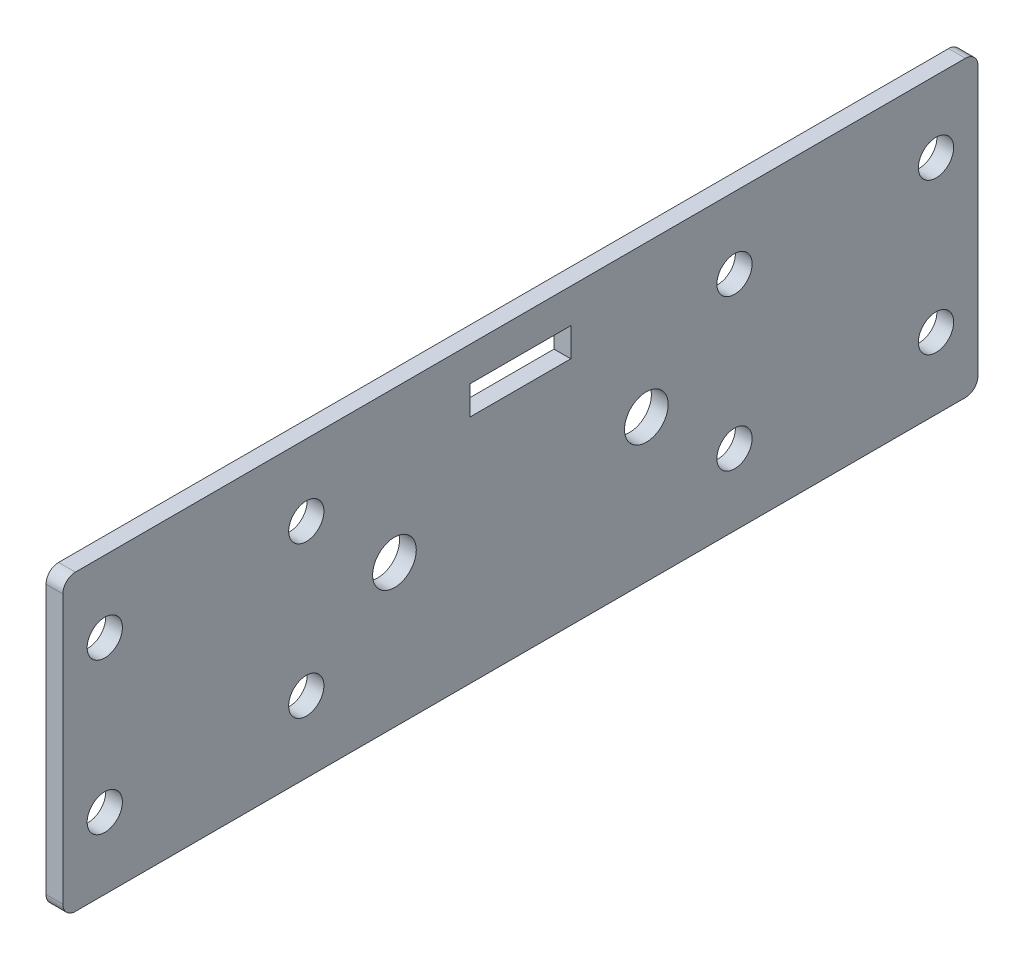
from build123d import *

# Parameters (mm, degrees)
SKETCH1_W           = 109
SKETCH1_H           = 35
SKETCH1_R           = 2.1
SKETCH1_R_2         = 2.6
SKETCH1_W_2         = 12
SKETCH1_H_2         = 3.42
BOSS_EXTRUDE1_DEPTH = 2
FILLET1_R           = 1.5


with BuildPart() as part:
    # Sketch1 → Boss-Extrude1 (new body)
    with BuildSketch(Plane(origin=(0, 0, 0), x_dir=(0, 0, -1), z_dir=(1, 0, 0))):
        with Locations((54.5, -17.5)):
            Rectangle(SKETCH1_W, SKETCH1_H)
        with Locations((104, -8.5)):
            Circle(SKETCH1_R, mode=Mode.SUBTRACT)
        with Locations(Location((104, -26.5, 0), (0, 0, 180))):
            Circle(SKETCH1_R, mode=Mode.SUBTRACT)
        with Locations((80, -26.5)):
            Circle(SKETCH1_R, mode=Mode.SUBTRACT)
        with Locations(Location((80, -8.5, 0), (0, 0, 180))):
            Circle(SKETCH1_R, mode=Mode.SUBTRACT)
        with Locations((5, -26.5)):
            Circle(SKETCH1_R, mode=Mode.SUBTRACT)
        with Locations(Location((5, -8.5, 0), (0, 0, 180))):
            Circle(SKETCH1_R, mode=Mode.SUBTRACT)
        with Locations(Location((29, -26.5, 0), (0, 0, 180))):
            Circle(SKETCH1_R, mode=Mode.SUBTRACT)
        with Locations((29, -8.5)):
            Circle(SKETCH1_R, mode=Mode.SUBTRACT)
        with Locations((39.5, -18)):
            Circle(SKETCH1_R_2, mode=Mode.SUBTRACT)
        with Locations(Location((69.5, -18, 0), (0, 0, 180))):
            Circle(SKETCH1_R_2, mode=Mode.SUBTRACT)
        with Locations((54.5, -5.79)):
            Rectangle(SKETCH1_W_2, SKETCH1_H_2, mode=Mode.SUBTRACT)
    extrude(amount=BOSS_EXTRUDE1_DEPTH)

    # Fillet1
    fillet1_edges = [part.edges().sort_by_distance(p)[0] for p in [
        (1, 0, 0),
        (1, 0, -109),
        (1, -35, -109),
        (1, -35, 0),
    ]]
    fillet(fillet1_edges, radius=FILLET1_R)


solid = part.part
